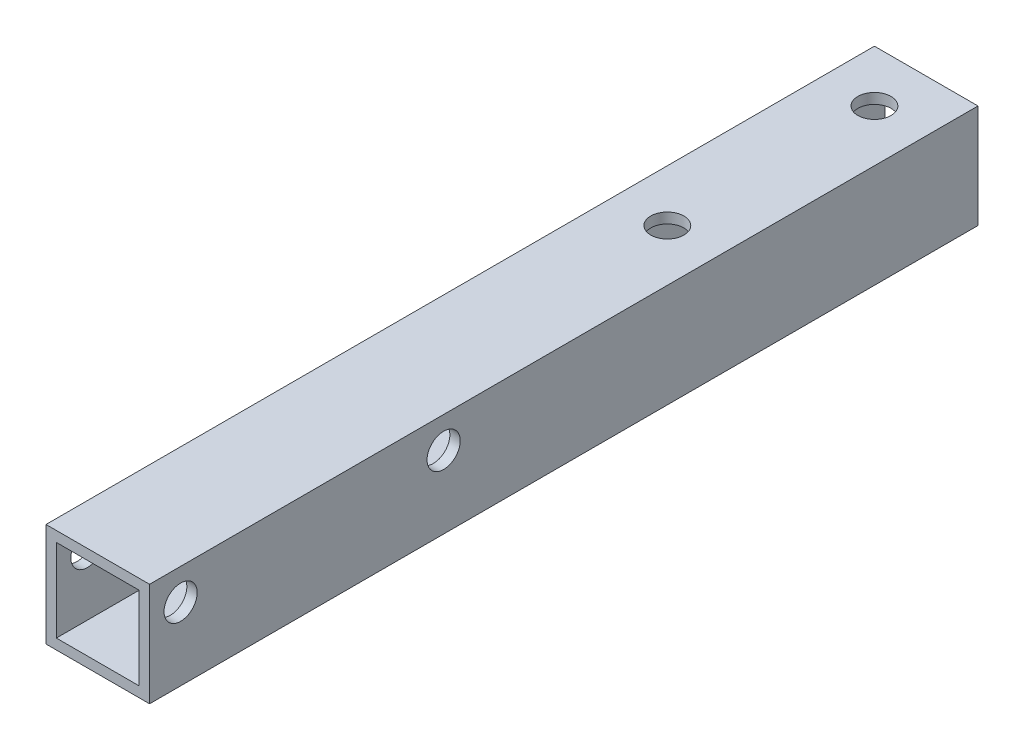
from build123d import *

# Parameters (mm, degrees)
SKETCH_1_W          = 10
SKETCH_1_H          = 10
SKETCH_1_W_2        = 8
SKETCH_1_H_2        = 8
EXTRUDE_1_DEPTH     = 80
SKETCH_2_R          = 1.6
CUT_EXTRUDE_1_DEPTH = 81.777472107
SKETCH_3_R          = 1.6
CUT_EXTRUDE_2_DEPTH = 81.777472107


with BuildPart() as part:
    # ｽｹｯﾁ1 → 押し出し-薄板1 (new body)
    with BuildSketch(Plane.XY):
        Rectangle(SKETCH_1_W, SKETCH_1_H)
        Rectangle(SKETCH_1_W_2, SKETCH_1_H_2, mode=Mode.SUBTRACT)
    extrude(amount=EXTRUDE_1_DEPTH)

    # ｽｹｯﾁ2 → ｶｯﾄ - 押し出し1 (cut, through all)
    with BuildSketch(Plane(origin=(0, 5, 0), x_dir=(1, 0, 0), z_dir=(0, 1, 0))):
        with Locations(Location((0, -5, 0), (0, 0, 180))):
            Circle(SKETCH_2_R)
        with Locations(Location((0, -25, 0), (0, 0, 180))):
            Circle(SKETCH_2_R)
    extrude(amount=-CUT_EXTRUDE_1_DEPTH, mode=Mode.SUBTRACT)

    # ｽｹｯﾁ3 → ｶｯﾄ - 押し出し2 (cut, through all)
    with BuildSketch(Plane.ZY.offset(5)):
        with Locations(Location((77, 2, 0), (0, 0, 270))):
            Circle(SKETCH_3_R)
        with Locations(Location((51.6, 2, 0), (0, 0, 270))):
            Circle(SKETCH_3_R)
    extrude(amount=-CUT_EXTRUDE_2_DEPTH, mode=Mode.SUBTRACT)


solid = part.part
